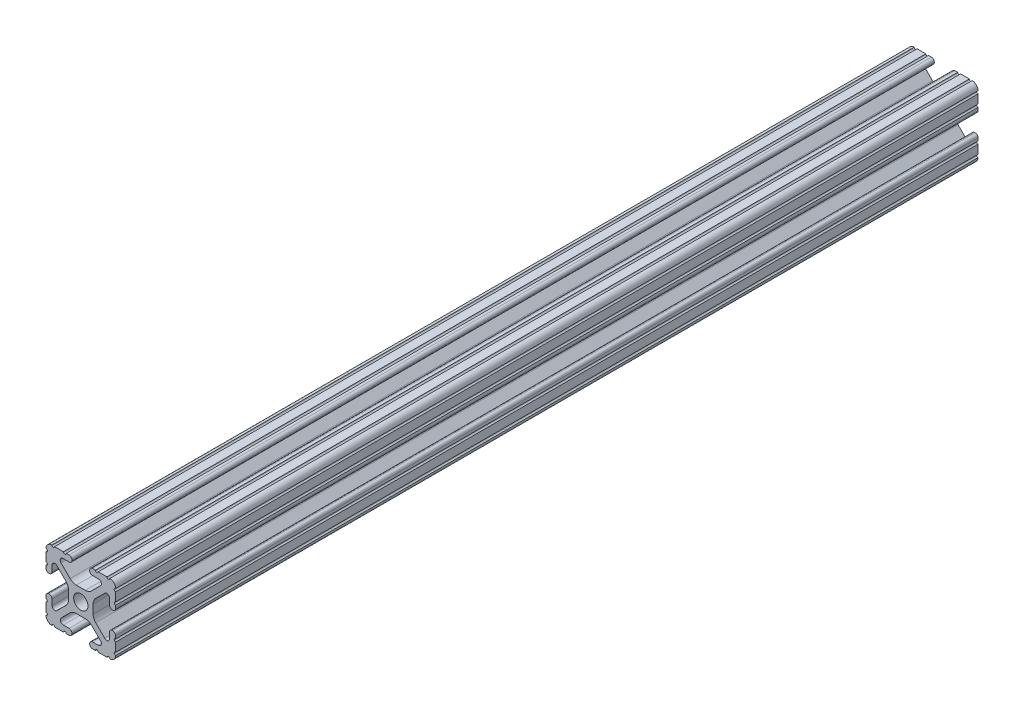
from build123d import *

# Parameters (mm, degrees)
SKETCH1_R           = 2.6035
BOSS_EXTRUDE1_DEPTH = 304.8
SKETCH2_W           = 54.534078776
SKETCH2_H           = 52.309705205
CUT_EXTRUDE1_DEPTH  = 294.894


with BuildPart() as part:
    # Sketch1 → Boss-Extrude1 (new, symmetric)
    with BuildSketch(Plane.XY):
        with BuildLine():
            Line((-7.179650497, -8.645192506), (-3.952270251, -5.423690499))
            ThreePointArc((-3.952270251, -5.423690499), (-2.922936451, -4.736929036), (-1.709253557, -4.4958))
            Line((-1.709253557, -4.4958), (1.709253557, -4.4958))
            ThreePointArc((1.709253557, -4.4958), (2.922936451, -4.736929036), (3.952270251, -5.423690499))
            Line((3.952270251, -5.423690499), (7.179650497, -8.645192506))
            ThreePointArc((7.179650497, -8.645192506), (7.41473083, -9.822813117), (6.416408329, -10.4902))
            Line((6.416408329, -10.4902), (4.287512407, -10.4902))
            ThreePointArc((4.287512407, -10.4902), (3.54574862, -10.79744862), (3.2385, -11.539212407))
            Line((3.2385, -11.539212407), (3.2385, -11.650987593))
            ThreePointArc((3.2385, -11.650987593), (3.54574862, -12.39275138), (4.287512407, -12.7))
            Line((4.287512407, -12.7), (5.317126718, -12.7))
            ThreePointArc((5.317126718, -12.7), (5.825126718, -12.192), (6.333126718, -12.7))
            Line((6.333126718, -12.7), (9.550443118, -12.7))
            ThreePointArc((9.550443118, -12.7), (10.058366869, -12.192000006), (10.566443095, -12.699847501))
            ThreePointArc((10.566443095, -12.699847501), (12.082537762, -12.08250727), (12.699846982, -10.566399977))
            ThreePointArc((12.699846982, -10.566399977), (12.192000006, -10.058323491), (12.7, -9.5504))
            Line((12.7, -9.5504), (12.7, -6.3330836))
            ThreePointArc((12.7, -6.3330836), (12.192, -5.8250836), (12.7, -5.3170836))
            Line((12.7, -5.3170836), (12.7, -4.287469289))
            ThreePointArc((12.7, -4.287469289), (12.39275138, -3.545705502), (11.650987593, -3.238456882))
            Line((11.650987593, -3.238456882), (11.539212407, -3.238456882))
            ThreePointArc((11.539212407, -3.238456882), (10.79744862, -3.545705502), (10.4902, -4.287469289))
            Line((10.4902, -4.287469289), (10.4902, -6.402089023))
            ThreePointArc((10.4902, -6.402089023), (9.856505071, -7.351067942), (8.737131347, -7.129408934))
            Line((8.737131347, -7.129408934), (5.441005833, -3.840816462))
            ThreePointArc((5.441005833, -3.840816462), (4.750877967, -2.809883091), (4.5085, -1.593185507))
            Line((4.5085, -1.593185507), (4.5085, 1.593185507))
            ThreePointArc((4.5085, 1.593185507), (4.750877967, 2.809883091), (5.441005833, 3.840816462))
            Line((5.441005833, 3.840816462), (8.737131347, 7.129408934))
            ThreePointArc((8.737131347, 7.129408934), (9.856505071, 7.351067942), (10.4902, 6.402089023))
            Line((10.4902, 6.402089023), (10.4902, 4.287469289))
            ThreePointArc((10.4902, 4.287469289), (10.79744862, 3.545705502), (11.539212407, 3.238456882))
            Line((11.539212407, 3.238456882), (11.650987593, 3.238456882))
            ThreePointArc((11.650987593, 3.238456882), (12.39275138, 3.545705502), (12.7, 4.287469289))
            Line((12.7, 4.287469289), (12.7, 5.3170836))
            ThreePointArc((12.7, 5.3170836), (12.192, 5.8250836), (12.7, 6.3330836))
            Line((12.7, 6.3330836), (12.7, 9.5504))
            ThreePointArc((12.7, 9.5504), (12.192000006, 10.058323491), (12.699846982, 10.566399977))
            ThreePointArc((12.699846982, 10.566399977), (12.082537762, 12.08250727), (10.566443095, 12.699847501))
            ThreePointArc((10.566443095, 12.699847501), (10.058366869, 12.192000006), (9.550443118, 12.7))
            Line((9.550443118, 12.7), (6.333126718, 12.7))
            ThreePointArc((6.333126718, 12.7), (5.825126718, 12.192), (5.317126718, 12.7))
            Line((5.317126718, 12.7), (4.287512407, 12.7))
            ThreePointArc((4.287512407, 12.7), (3.54574862, 12.39275138), (3.2385, 11.650987593))
            Line((3.2385, 11.650987593), (3.2385, 11.539212407))
            ThreePointArc((3.2385, 11.539212407), (3.54574862, 10.79744862), (4.287512407, 10.4902))
            Line((4.287512407, 10.4902), (6.476788598, 10.4902))
            ThreePointArc((6.476788598, 10.4902), (7.432222385, 9.85140422), (7.207036008, 8.724370562))
            Line((7.207036008, 8.724370562), (3.898272566, 5.423169045))
            ThreePointArc((3.898272566, 5.423169045), (2.869120213, 4.736787962), (1.655778399, 4.4958))
            Line((1.655778399, 4.4958), (-1.655778399, 4.4958))
            ThreePointArc((-1.655778399, 4.4958), (-2.869120213, 4.736787962), (-3.898272566, 5.423169045))
            Line((-3.898272566, 5.423169045), (-7.207036008, 8.724370562))
            ThreePointArc((-7.207036008, 8.724370562), (-7.432222385, 9.85140422), (-6.476788598, 10.4902))
            Line((-6.476788598, 10.4902), (-4.287512407, 10.4902))
            ThreePointArc((-4.287512407, 10.4902), (-3.54574862, 10.79744862), (-3.2385, 11.539212407))
            Line((-3.2385, 11.539212407), (-3.2385, 11.650987593))
            ThreePointArc((-3.2385, 11.650987593), (-3.54574862, 12.39275138), (-4.287512407, 12.7))
            Line((-4.287512407, 12.7), (-5.317126718, 12.7))
            ThreePointArc((-5.317126718, 12.7), (-5.825126718, 12.192), (-6.333126718, 12.7))
            Line((-6.333126718, 12.7), (-9.550443118, 12.7))
            ThreePointArc((-9.550443118, 12.7), (-10.058366869, 12.192000006), (-10.566443095, 12.699847501))
            ThreePointArc((-10.566443095, 12.699847501), (-12.082537762, 12.08250727), (-12.699846982, 10.566399977))
            ThreePointArc((-12.699846982, 10.566399977), (-12.192000006, 10.058323491), (-12.7, 9.5504))
            Line((-12.7, 9.5504), (-12.7, 6.3330836))
            ThreePointArc((-12.7, 6.3330836), (-12.192, 5.8250836), (-12.7, 5.3170836))
            Line((-12.7, 5.3170836), (-12.7, 4.287469289))
            ThreePointArc((-12.7, 4.287469289), (-12.39275138, 3.545705502), (-11.650987593, 3.238456882))
            Line((-11.650987593, 3.238456882), (-11.539212407, 3.238456882))
            ThreePointArc((-11.539212407, 3.238456882), (-10.79744862, 3.545705502), (-10.4902, 4.287469289))
            Line((-10.4902, 4.287469289), (-10.4902, 6.402089023))
            ThreePointArc((-10.4902, 6.402089023), (-9.856505071, 7.351067942), (-8.737131347, 7.129408934))
            Line((-8.737131347, 7.129408934), (-5.441005833, 3.840816462))
            ThreePointArc((-5.441005833, 3.840816462), (-4.750877967, 2.809883091), (-4.5085, 1.593185507))
            Line((-4.5085, 1.593185507), (-4.5085, -1.593185507))
            ThreePointArc((-4.5085, -1.593185507), (-4.750877967, -2.809883091), (-5.441005833, -3.840816462))
            Line((-5.441005833, -3.840816462), (-8.737131347, -7.129408934))
            ThreePointArc((-8.737131347, -7.129408934), (-9.856505071, -7.351067942), (-10.4902, -6.402089023))
            Line((-10.4902, -6.402089023), (-10.4902, -4.287469289))
            ThreePointArc((-10.4902, -4.287469289), (-10.79744862, -3.545705502), (-11.539212407, -3.238456882))
            Line((-11.539212407, -3.238456882), (-11.650987593, -3.238456882))
            ThreePointArc((-11.650987593, -3.238456882), (-12.39275138, -3.545705502), (-12.7, -4.287469289))
            Line((-12.7, -4.287469289), (-12.7, -5.3170836))
            ThreePointArc((-12.7, -5.3170836), (-12.192, -5.8250836), (-12.7, -6.3330836))
            Line((-12.7, -6.3330836), (-12.7, -9.5504))
            ThreePointArc((-12.7, -9.5504), (-12.192000006, -10.058323491), (-12.699846982, -10.566399977))
            ThreePointArc((-12.699846982, -10.566399977), (-12.082537762, -12.08250727), (-10.566443095, -12.699847501))
            ThreePointArc((-10.566443095, -12.699847501), (-10.058366869, -12.192000006), (-9.550443118, -12.7))
            Line((-9.550443118, -12.7), (-6.333126718, -12.7))
            ThreePointArc((-6.333126718, -12.7), (-5.825126718, -12.192), (-5.317126718, -12.7))
            Line((-5.317126718, -12.7), (-4.287512407, -12.7))
            ThreePointArc((-4.287512407, -12.7), (-3.54574862, -12.39275138), (-3.2385, -11.650987593))
            Line((-3.2385, -11.650987593), (-3.2385, -11.539212407))
            ThreePointArc((-3.2385, -11.539212407), (-3.54574862, -10.79744862), (-4.287512407, -10.4902))
            Line((-4.287512407, -10.4902), (-6.416408329, -10.4902))
            ThreePointArc((-6.416408329, -10.4902), (-7.41473083, -9.822813117), (-7.179650497, -8.645192506))
        make_face()
        with Locations(Location((0, 0, 0), (0, 0, 180))):
            Circle(SKETCH1_R, mode=Mode.SUBTRACT)
    extrude(amount=BOSS_EXTRUDE1_DEPTH, both=True)

    # Sketch2 → Cut-Extrude1 (cut)
    with BuildSketch(Plane.XY.offset(304.8)):
        with Locations((3.588199908, -2.803361197)):
            Rectangle(SKETCH2_W, SKETCH2_H)
    extrude(amount=-CUT_EXTRUDE1_DEPTH, mode=Mode.SUBTRACT)


solid = part.part
